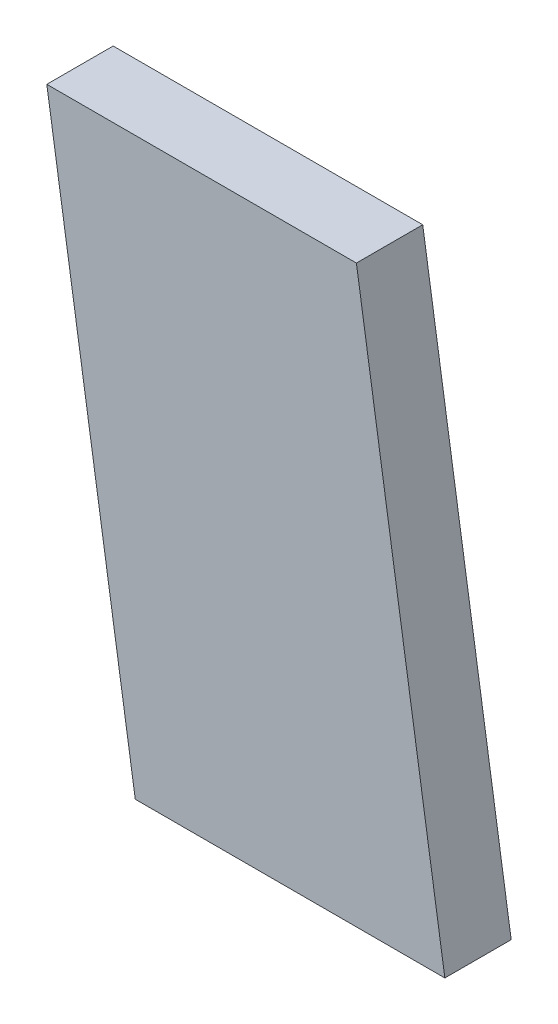
from build123d import *

# Parameters (mm, degrees)
BOSS_EXTRUDE1_DEPTH = 15


with BuildPart() as part:
    # Sketch1 → Boss-Extrude1 (new body)
    with BuildSketch(Plane.XY):
        Polygon((2000, 450), (1980, 580), (2050, 580), (2070, 450), align=None)
    extrude(amount=BOSS_EXTRUDE1_DEPTH)


solid = part.part
